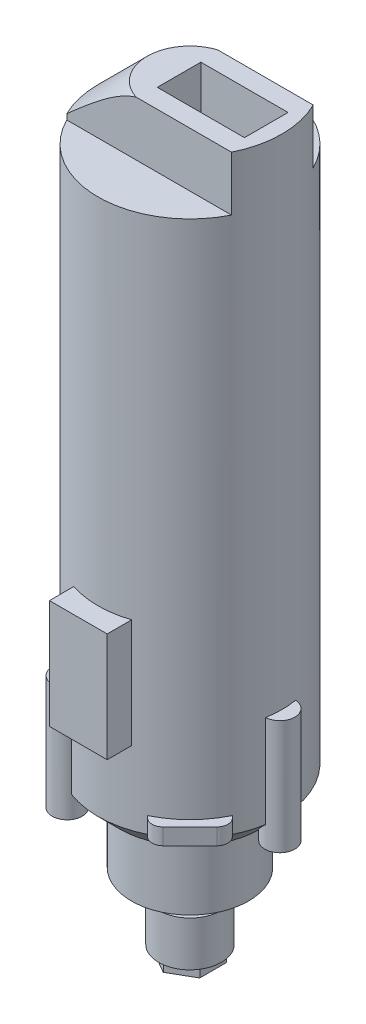
from build123d import *
from build123d.topology import SkipClean

# Parameters (mm, degrees)
SKIZZE2_W                       = 21.201346
SKIZZE2_H                       = 40
AUFSATZ_LINEAR_AUSTRAGEN1_DEPTH = 41
SKIZZE3_R                       = 5.5
AUFSATZ_LINEAR_AUSTRAGEN2_DEPTH = 42
SKIZZE4_R                       = 4
SCHNITT_LINEAR_AUSTRAGEN1_DEPTH = 25
SKIZZE5_OUTSIDE_W               = 129.992
SKIZZE5_OUTSIDE_H               = 132.821
SCHNITT_LINEAR_AUSTRAGEN2_DEPTH = 4
SKIZZE6_W                       = 6
SKIZZE6_H                       = 22
AUFSATZ_LINEAR_AUSTRAGEN3_DEPTH = 37
VERRUNDUNG1_R                   = 4
AUFSATZ_LINEAR_START            = 20
AUFSATZ_LINEAR_AUSTRAGEN4_DEPTH = 20
SKIZZE8_W                       = 32
SKIZZE8_H                       = 16
SCHNITT_LINEAR_AUSTRAGEN3_DEPTH = 30
FASE1_SIZE                      = 18


with BuildPart() as part:
    # Skizze1 → Rotation1 (revolve)
    with BuildSketch(Plane.XY):
        Polygon((8.5, 0), (21.5, 0), (21.5, 25), (25.75, 25), (33.75, 33), (33.75, 230), (0, 230), (0, -28.5), (11.5, -28.5), (11.5, -8), (8.5, -8), align=None)
    revolve(axis=Axis((0, 0, 0), (0, 1, 0)))

    # Skizze2 → Aufsatz-Linear austragen1 (add)
    with BuildSketch(Plane.XY):
        with Locations((0, 80)):
            Rectangle(SKIZZE2_W, SKIZZE2_H)
    extrude(amount=AUFSATZ_LINEAR_AUSTRAGEN1_DEPTH)

    # Skizze3 → Aufsatz-Linear austragen2 (add)
    with BuildSketch(Plane.XZ.offset(-25)):
        with Locations((33, 0)):
            Circle(SKIZZE3_R)
        with Locations((-16.5, 28.578838)):
            Circle(SKIZZE3_R)
        with Locations((-16.5, -28.578838)):
            Circle(SKIZZE3_R)
    extrude(amount=-AUFSATZ_LINEAR_AUSTRAGEN2_DEPTH)

    # Skizze4 → Schnitt-Linear austragen1 (cut)
    with BuildSketch(Plane.XZ.offset(28.5)):
        Circle(SKIZZE4_R)
    extrude(amount=-SCHNITT_LINEAR_AUSTRAGEN1_DEPTH, mode=Mode.SUBTRACT)

    # Skizze5 outside → Schnitt-Linear austragen2 (cut)
    with BuildSketch(Plane.XZ.offset(28.5)):
        with Locations((2.375, 3.4605)):
            Rectangle(SKIZZE5_OUTSIDE_W, SKIZZE5_OUTSIDE_H)
        Polygon((-8.5, -4.907477), (0, -9.814955), (8.5, -4.907477), (8.5, 4.907477), (0, 9.814955), (-8.5, 4.907477), align=None, mode=Mode.SUBTRACT)
    extrude(amount=-SCHNITT_LINEAR_AUSTRAGEN2_DEPTH, mode=Mode.SUBTRACT)

    # Skizze6 → Aufsatz-Linear austragen3 (add)
    with BuildSketch(Plane(origin=(0, 0, 0), x_dir=(0, 1, 0), z_dir=(0.7071067811865488, 0, 0.7071067811865464))):
        with Locations((36, 0)):
            Rectangle(SKIZZE6_W, SKIZZE6_H)
    extrude(amount=AUFSATZ_LINEAR_AUSTRAGEN3_DEPTH)

    # Verrundung1
    verrundung1_edges = [part.edges().sort_by_distance(p)[0] for p in [
        (18.384776, 36, 33.941125),
        (33.941125, 36, 18.384776),
    ]]
    fillet(verrundung1_edges, radius=VERRUNDUNG1_R)

    # Skizze7 → Aufsatz-Linear austragen4 (add)
    with SkipClean():  # the faces are left unmerged after this step: merging them gives an invalid solid
        with BuildSketch(Plane(origin=(0, 230, 0), x_dir=(1, 0, 0), z_dir=(0, 1, 0)).offset(AUFSATZ_LINEAR_START)):
            with BuildLine():
                Line((-30.233467, 15), (30.233467, 15))
                ThreePointArc((30.233467, 15), (33.75, 0), (30.233467, -15))
                Line((30.233467, -15), (-30.233467, -15))
                ThreePointArc((-30.233467, -15), (-33.75, 0), (-30.233467, 15))
            make_face()
        extrude(amount=-AUFSATZ_LINEAR_AUSTRAGEN4_DEPTH)

    # Skizze8 → Schnitt-Linear austragen3 (cut)
    with SkipClean():  # the faces are left unmerged after this step: merging them gives an invalid solid
        with BuildSketch(Plane(origin=(0, 250, 0), x_dir=(1, 0, 0), z_dir=(0, 1, 0))):
            with Locations((12, 0)):
                Rectangle(SKIZZE8_W, SKIZZE8_H)
        extrude(amount=-SCHNITT_LINEAR_AUSTRAGEN3_DEPTH, mode=Mode.SUBTRACT)

    # Fase1
    fase1_edges = [part.edges().sort_by_distance(p)[0] for p in [
        (-33.75, 250, 0),
    ]]
    chamfer(fase1_edges, length=FASE1_SIZE)


solid = part.part
